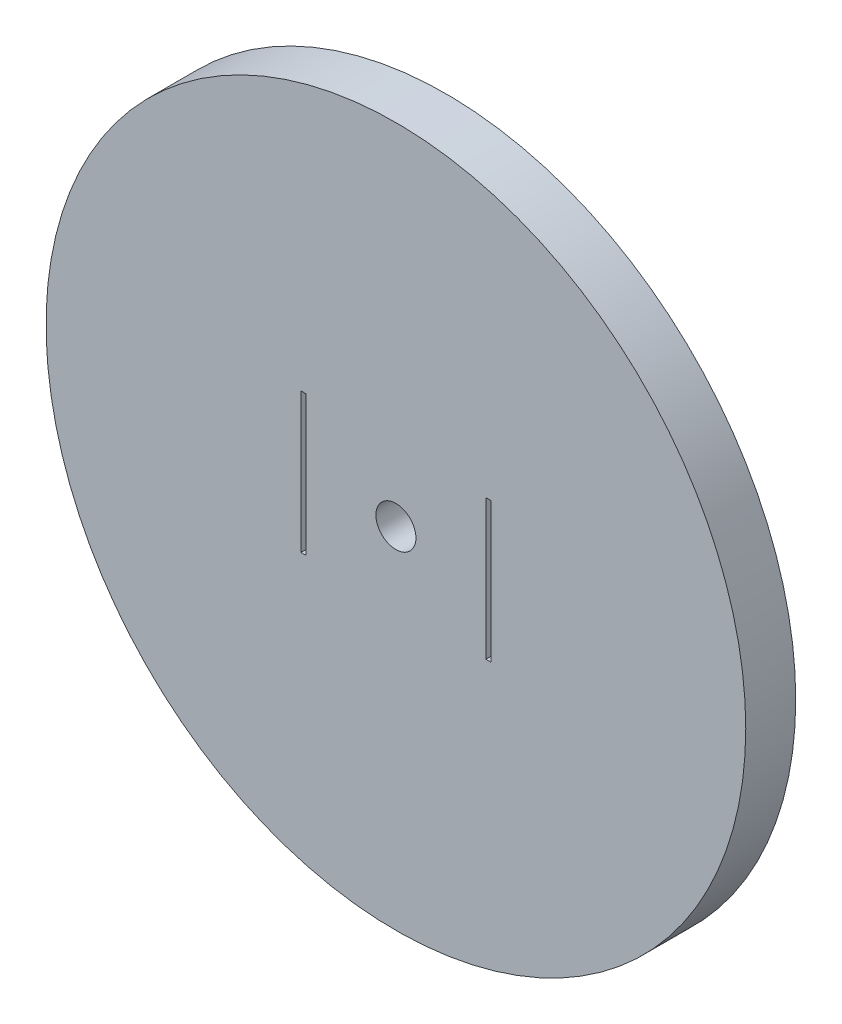
from build123d import *

# Parameters (mm, degrees)
SKETCH1_R           = 35
SKETCH1_R_2         = 2
SKETCH1_W           = 0.5
SKETCH1_H           = 14
BOSS_EXTRUDE1_DEPTH = 5


with BuildPart() as part:
    # Sketch1 → Boss-Extrude1 (new body)
    with BuildSketch(Plane.XY):
        Circle(SKETCH1_R)
        Circle(SKETCH1_R_2, mode=Mode.SUBTRACT)
        with Locations((-9.25, 0)):
            Rectangle(SKETCH1_W, SKETCH1_H, mode=Mode.SUBTRACT)
        with Locations((9.25, 0)):
            Rectangle(SKETCH1_W, SKETCH1_H, mode=Mode.SUBTRACT)
    extrude(amount=BOSS_EXTRUDE1_DEPTH)

    # Sketch3 → Revolve1 (revolve)
    with BuildSketch(Plane(origin=(0, 0, 0), x_dir=(1, 0, 0), z_dir=(0, 1, 0))):
        with BuildLine():
            Line((-32.35, 14.632072887), (-32.35, 0))
            Line((-32.35, 0), (-28, 0))
            Line((-28, 0), (-28, 18.982072887))
            ThreePointArc((-28, 18.982072887), (-31.075914498, 17.707987385), (-32.35, 14.632072887))
        make_face()
    revolve(axis=Axis((-28, 0, -14.632072887), (0, 0, 1)))


solid = part.part
